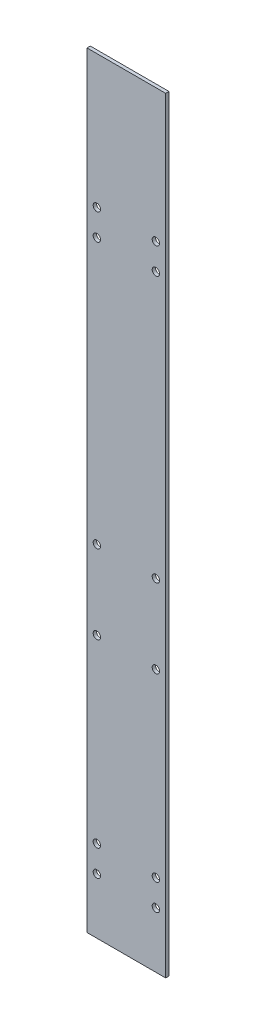
from build123d import *

# Parameters (mm, degrees)
SKETCH1_W                   = 76.2
SKETCH1_H                   = 741.680000144
BOSS_EXTRUDE1_DEPTH         = 3.175
F_1_4_CLEARANCE_HOLE1_D     = 7.14248
F_1_4_CLEARANCE_HOLE1_DEPTH = 50.8
F_1_4_CLEARANCE_HOLE1_TIP   = 2.145817477


with BuildPart() as part:
    # Sketch1 → Boss-Extrude1 (new body)
    with BuildSketch(Plane.XY):
        with Locations((-363.22, 5565.140000072)):
            Rectangle(SKETCH1_W, SKETCH1_H)
    extrude(amount=BOSS_EXTRUDE1_DEPTH)

    # 1/4 Clearance Hole1
    with Locations(Plane.XY.offset(3.175)):
        with Locations((-391.795, 5248.275), (-391.795, 5273.675), (-334.645, 5273.675), (-334.645, 5248.275), (-334.645, 5781.675), (-334.645, 5807.075), (-391.795, 5807.075), (-391.795, 5781.675), (-391.795, 5448.3), (-334.645, 5448.3), (-391.795, 5524.5), (-334.645, 5524.5), (334.645, 5524.5), (391.795, 5524.5), (334.645, 5448.3), (391.795, 5448.3), (391.795, 5781.675), (391.795, 5807.075), (334.645, 5807.075), (334.645, 5781.675), (334.645, 5248.275), (334.645, 5273.675), (391.795, 5273.675), (391.795, 5248.275)):
            Hole(F_1_4_CLEARANCE_HOLE1_D / 2, depth=F_1_4_CLEARANCE_HOLE1_DEPTH)
            with Locations((0, 0, -(F_1_4_CLEARANCE_HOLE1_DEPTH + F_1_4_CLEARANCE_HOLE1_TIP / 2))):  # 118° drill point
                Cone(0, F_1_4_CLEARANCE_HOLE1_D / 2, F_1_4_CLEARANCE_HOLE1_TIP, mode=Mode.SUBTRACT)


solid = part.part
